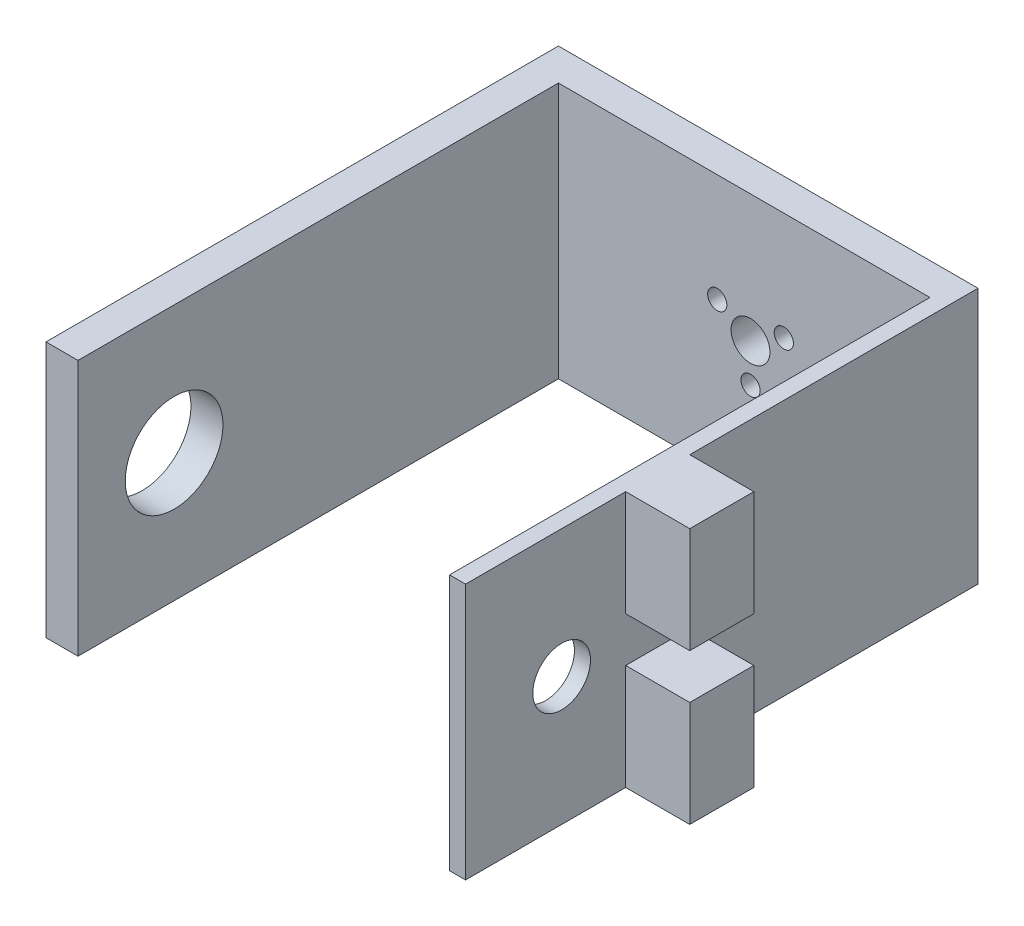
from build123d import *

# Parameters (mm, degrees)
BOSS_EXTRUDE1_DEPTH = 40
SKETCH2_R           = 1.5
CUT_EXTRUDE1_DEPTH  = 97.046863561
CUT_EXTRUDE2_REACH  = 89.618
SKETCH3_R           = 7.625
SKETCH4_R           = 4.5
CUT_EXTRUDE4_DEPTH  = 10
SKETCH4_4_W         = 10
SKETCH4_4_H         = 16.5
BOSS_EXTRUDE2_DEPTH = 10
CUT_EXTRUDE5_REACH  = 100.185
SKETCH2_3_R         = 3.035


with BuildPart() as part:
    # Sketch1 → Boss-Extrude1 (new body)
    with BuildSketch(Plane(origin=(0, 0, 0), x_dir=(1, 0, 0), z_dir=(0, 1, 0))):
        Polygon((-35, -42.269292904), (-30, -42.269292904), (-30, 32.730707096), (28, 32.730707096), (28, -42.269292904), (30.5, -42.269292904), (30.5, 37.730707096), (-35, 37.730707096), align=None)
    extrude(amount=BOSS_EXTRUDE1_DEPTH)

    # Sketch2 → Cut-Extrude1 (cut, through all)
    with BuildSketch(Plane(origin=(0, 0, -37.730707096), x_dir=(-1, 0, 0), z_dir=(0, 0, -1))):
        with Locations((0.012189814, 14.125589177)):
            Circle(SKETCH2_R)
        with Locations((-5.183962609, 23.125589177)):
            Circle(SKETCH2_R)
        with Locations((5.208342236, 23.125589177)):
            Circle(SKETCH2_R)
    extrude(amount=-CUT_EXTRUDE1_DEPTH, mode=Mode.SUBTRACT)

    # Sketch3 → Cut-Extrude2 (cut, up to next)
    with BuildSketch(Plane.ZY.offset(35), mode=Mode.PRIVATE) as cut_extrude2_sk1:
        with Locations((27.269292904, 20)):
            Circle(SKETCH3_R)
    cut_extrude2_tool1 = extrude(cut_extrude2_sk1.sketch, amount=-CUT_EXTRUDE2_REACH, mode=Mode.PRIVATE) & part.part
    add(cut_extrude2_tool1.solids().sort_by_distance((-35, 20, 27.269293))[0], mode=Mode.SUBTRACT)

    # Sketch4 → Cut-Extrude4 (cut)
    with BuildSketch(Plane(origin=(30.5, 0, 0), x_dir=(0, 0, -1), z_dir=(1, 0, 0))):
        with Locations((-27.269292904, 20)):
            Circle(SKETCH4_R)
    extrude(amount=-CUT_EXTRUDE4_DEPTH, mode=Mode.SUBTRACT)

    # Sketch4<4> → Boss-Extrude2 (add)
    with BuildSketch(Plane(origin=(30.5, 0, 0), x_dir=(0, 0, -1), z_dir=(1, 0, 0))):
        with Locations((-12.269292904, 31.75)):
            Rectangle(SKETCH4_4_W, SKETCH4_4_H)
        with Locations((-12.269292904, 8.25)):
            Rectangle(SKETCH4_4_W, SKETCH4_4_H)
    extrude(amount=BOSS_EXTRUDE2_DEPTH)

    # Sketch2<3> → Cut-Extrude5 (cut, up to next)
    with BuildSketch(Plane(origin=(0, 0, -37.730707096), x_dir=(-1, 0, 0), z_dir=(0, 0, -1)), mode=Mode.PRIVATE) as cut_extrude5_sk1:
        with Locations((0.012189814, 20.125589177)):
            Circle(SKETCH2_3_R)
    cut_extrude5_tool1 = extrude(cut_extrude5_sk1.sketch, amount=-CUT_EXTRUDE5_REACH, mode=Mode.PRIVATE) & part.part
    add(cut_extrude5_tool1.solids().sort_by_distance((-0.01219, 20.125589, -37.730707))[0], mode=Mode.SUBTRACT)


solid = part.part
